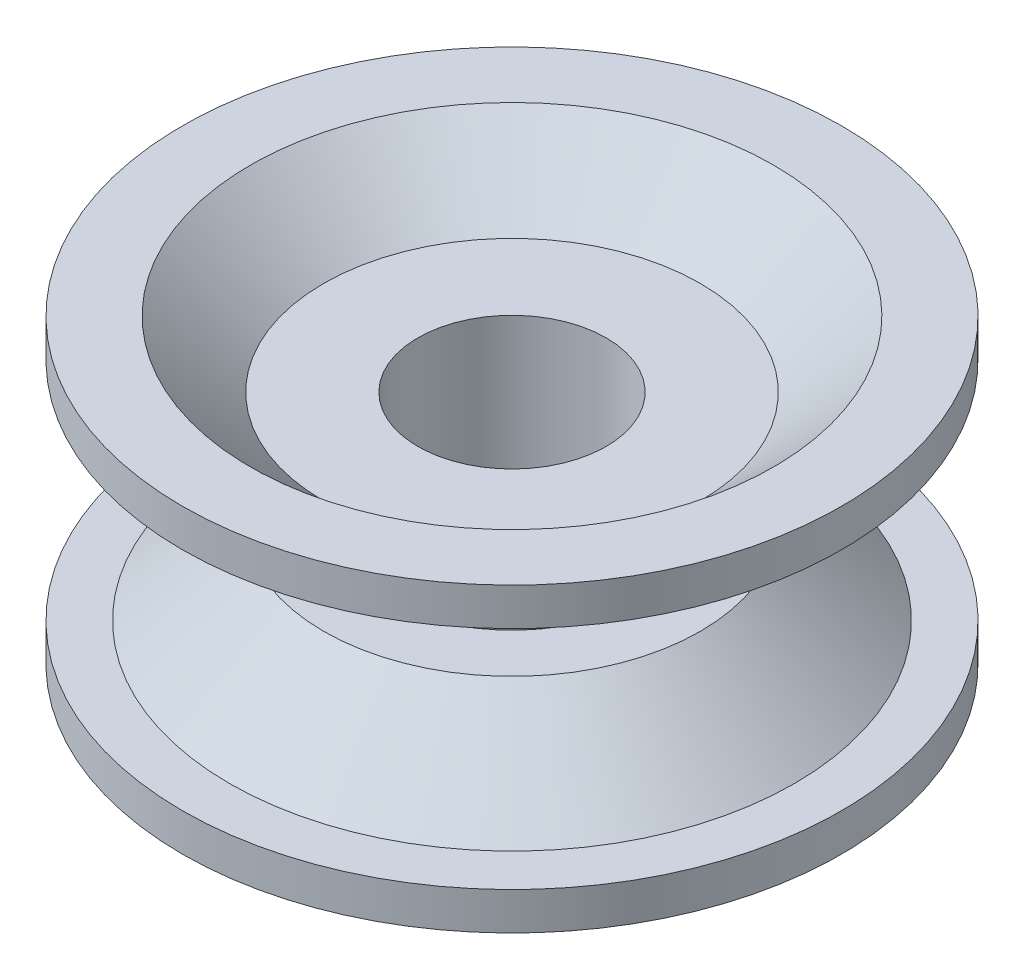
from build123d import *


with BuildPart() as part:
    # Esquisse1 → Révolution1 (revolve)
    with BuildSketch(Plane.XY, mode=Mode.PRIVATE) as r_volution1_sk:
        Polygon((2.777777778, -1.6), (3.5, -1.6), (3.5, -1.2), (3, -1.2), (2, -0.3), (1.4, -0.3), (1.4, 0.3), (2, 0.3), (3, 1.2), (3.5, 1.2), (3.5, 1.6), (2.777777778, 1.6), (2, 0.9), (1, 0.9), (1, -2.4), (1.4, -2.4), (1.4, -0.9), (2, -0.9), align=None)
    revolve(r_volution1_sk.sketch.rotate(Axis((0, 0, 0), (0, 1, 0)), 90), axis=Axis((0, 0, 0), (0, 1, 0)))


solid = part.part
